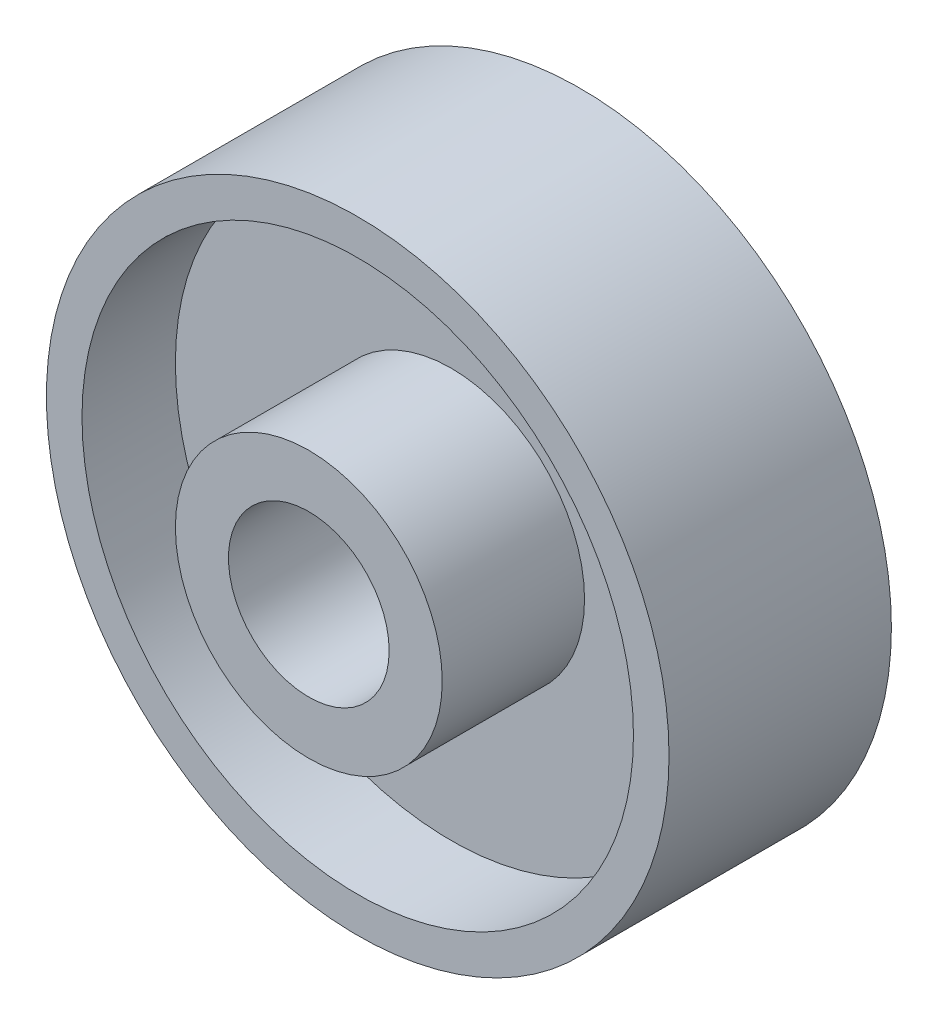
from build123d import *

# Parameters (mm, degrees)
BOSS_EXTRUDE1_DEPTH      = 36
BOSS_EXTRUDE1_DEPTH_BACK = 36
SKETCH1_R                = 30
SKETCH1_R_2              = 18.065
BOSS_EXTRUDE2_DEPTH      = 4
BOSS_EXTRUDE2_DEPTH_BACK = 4
SKETCH1_3_R              = 62
SKETCH1_3_R_2            = 30
BOSS_EXTRUDE3_DEPTH      = 25
BOSS_EXTRUDE3_DEPTH_BACK = 25
SKETCH1_4_R              = 70
SKETCH1_4_R_2            = 62


with BuildPart() as part:
    # Sketch1 → Boss-Extrude1 (new, two sides: drawn at the far end of the back side and taken through both)
    with BuildSketch(Plane.XY.offset(-BOSS_EXTRUDE1_DEPTH_BACK)):
        Circle(SKETCH1_R)
        Circle(SKETCH1_R_2, mode=Mode.SUBTRACT)
    extrude(amount=BOSS_EXTRUDE1_DEPTH + BOSS_EXTRUDE1_DEPTH_BACK)

    # Sketch1<3> → Boss-Extrude2 (add, two sides: drawn at the far end of the back side and taken through both)
    with BuildSketch(Plane.XY.offset(-BOSS_EXTRUDE2_DEPTH_BACK)):
        Circle(SKETCH1_3_R)
        Circle(SKETCH1_3_R_2, mode=Mode.SUBTRACT)
    extrude(amount=BOSS_EXTRUDE2_DEPTH + BOSS_EXTRUDE2_DEPTH_BACK)

    # Sketch1<4> → Boss-Extrude3 (add, two sides: drawn at the far end of the back side and taken through both)
    with BuildSketch(Plane.XY.offset(-BOSS_EXTRUDE3_DEPTH_BACK)):
        Circle(SKETCH1_4_R)
        Circle(SKETCH1_4_R_2, mode=Mode.SUBTRACT)
    extrude(amount=BOSS_EXTRUDE3_DEPTH + BOSS_EXTRUDE3_DEPTH_BACK)


solid = part.part
